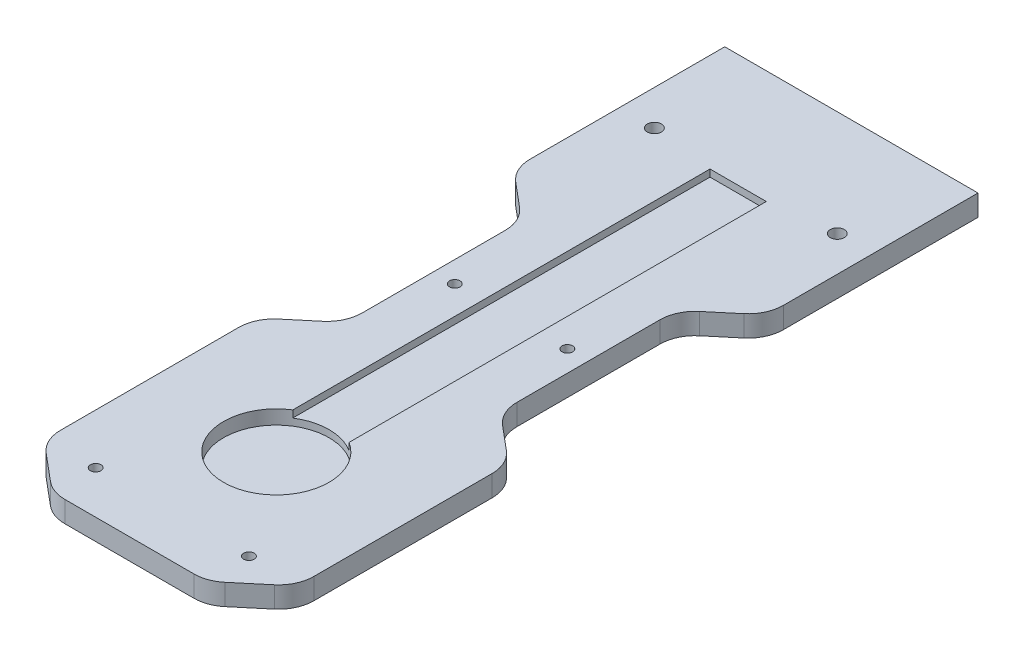
from build123d import *

# Parameters (mm, degrees)
BOSS_EXTRUDE1_DEPTH = 6
FILLET1_R           = 10
SKETCH2_R           = 2.5
CUT_EXTRUDE1_DEPTH  = 6
SKETCH8_W           = 16
SKETCH8_H           = 121.699623713
CUT_EXTRUDE5_DEPTH  = 2
SKETCH9_R           = 15
CUT_EXTRUDE6_DEPTH  = 4
SKETCH10_R          = 4.460390543
BOSS_EXTRUDE2_DEPTH = 2
FILLET2_R           = 10
SKETCH12_R          = 1.5
CUT_EXTRUDE7_DEPTH  = 10
SKETCH13_R          = 1.5
CUT_EXTRUDE8_DEPTH  = 10
SKETCH14_R          = 2
CUT_EXTRUDE9_DEPTH  = 10


with BuildPart() as part:
    # Sketch1 → Boss-Extrude1 (new body)
    with BuildSketch(Plane(origin=(0, 0, 0), x_dir=(1, 0, 0), z_dir=(0, 1, 0))):
        Polygon((21.213083016, -102.227633762), (35.213083016, -90.480238926), (35.213083016, -30.480238926), (21.213083016, -18.73284409), (21.213083016, 31.26715591), (35.213083016, 43.014550747), (35.213083016, 103.014550747), (-36.786916984, 103.014550747), (-36.786916984, 43.014550747), (-22.786916984, 31.26715591), (-22.786916984, -18.73284409), (-36.786916984, -30.480238926), (-36.786916984, -90.480238926), (-22.786916984, -102.227633762), align=None)
    extrude(amount=BOSS_EXTRUDE1_DEPTH)

    # Fillet1
    fillet1_edges = [part.edges().sort_by_distance(p)[0] for p in [
        (-22.786916984, 3, 102.227633762),
        (-36.786916984, 3, 90.480238926),
        (-36.786916984, 3, 30.480238926),
        (-22.786916984, 3, 18.73284409),
        (21.213083016, 3, 18.73284409),
        (35.213083016, 3, 30.480238926),
        (35.213083016, 3, 90.480238926),
        (21.213083016, 3, 102.227633762),
    ]]
    fillet(fillet1_edges, radius=FILLET1_R)

    # Sketch2 → Cut-Extrude1 (cut)
    with BuildSketch(Plane.XZ):
        with Locations(Location((-0.786916984, 60.480238926, 0), (0, 0, 270))):
            Circle(SKETCH2_R)
    extrude(amount=-CUT_EXTRUDE1_DEPTH, mode=Mode.SUBTRACT)

    # Sketch8 → Cut-Extrude5 (cut)
    with BuildSketch(Plane(origin=(0, 6, 0), x_dir=(1, 0, 0), z_dir=(0, 1, 0))):
        with Locations((-0.786916984, 9.974259286)):
            Rectangle(SKETCH8_W, SKETCH8_H)
    extrude(amount=-CUT_EXTRUDE5_DEPTH, mode=Mode.SUBTRACT)

    # Sketch9 → Cut-Extrude6 (cut)
    with BuildSketch(Plane(origin=(0, 6, 0), x_dir=(1, 0, 0), z_dir=(0, 1, 0))):
        with Locations(Location((-0.786916984, -60.480238926, 0), (0, 0, 270))):
            Circle(SKETCH9_R)
    extrude(amount=-CUT_EXTRUDE6_DEPTH, mode=Mode.SUBTRACT)

    # Sketch10 → Boss-Extrude2 (add)
    with BuildSketch(Plane(origin=(0, 2, 0), x_dir=(1, 0, 0), z_dir=(0, 1, 0))):
        with Locations((-0.786916984, -60.480238926)):
            Circle(SKETCH10_R)
    extrude(amount=-BOSS_EXTRUDE2_DEPTH)

    # Fillet2
    fillet2_edges = [part.edges().sort_by_distance(p)[0] for p in [
        (-22.786916984, 3, -31.26715591),
        (-36.786916984, 3, -43.014550747),
        (35.213083016, 3, -43.014550747),
        (21.213083016, 3, -31.26715591),
    ]]
    fillet(fillet2_edges, radius=FILLET2_R)

    # Sketch12 → Cut-Extrude7 (cut)
    with BuildSketch(Plane(origin=(0, 6, 0), x_dir=(1, 0, 0), z_dir=(0, 1, 0))):
        with Locations(Location((15.213083016, 6.26715591, 0), (0, 0, 270))):
            Circle(SKETCH12_R)
        with Locations(Location((-16.786916984, 6.26715591, 0), (0, 0, 270))):
            Circle(SKETCH12_R)
    extrude(amount=-CUT_EXTRUDE7_DEPTH, mode=Mode.SUBTRACT)

    # Sketch13 → Cut-Extrude8 (cut)
    with BuildSketch(Plane.XZ):
        with Locations(Location((-22.567416075, 90.043344962, 0), (0, 0, 270))):
            Circle(SKETCH13_R)
        with Locations(Location((20.993582106, 90.043344962, 0), (0, 0, 90))):
            Circle(SKETCH13_R)
    extrude(amount=-CUT_EXTRUDE8_DEPTH, mode=Mode.SUBTRACT)

    # Sketch14 → Cut-Extrude9 (cut)
    with BuildSketch(Plane.XZ):
        with Locations(Location((-26.786916984, -73.014550747, 0), (0, 0, 270))):
            Circle(SKETCH14_R)
        with Locations(Location((25.213083016, -73.014550747, 0), (0, 0, 270))):
            Circle(SKETCH14_R)
    extrude(amount=-CUT_EXTRUDE9_DEPTH, mode=Mode.SUBTRACT)


solid = part.part
